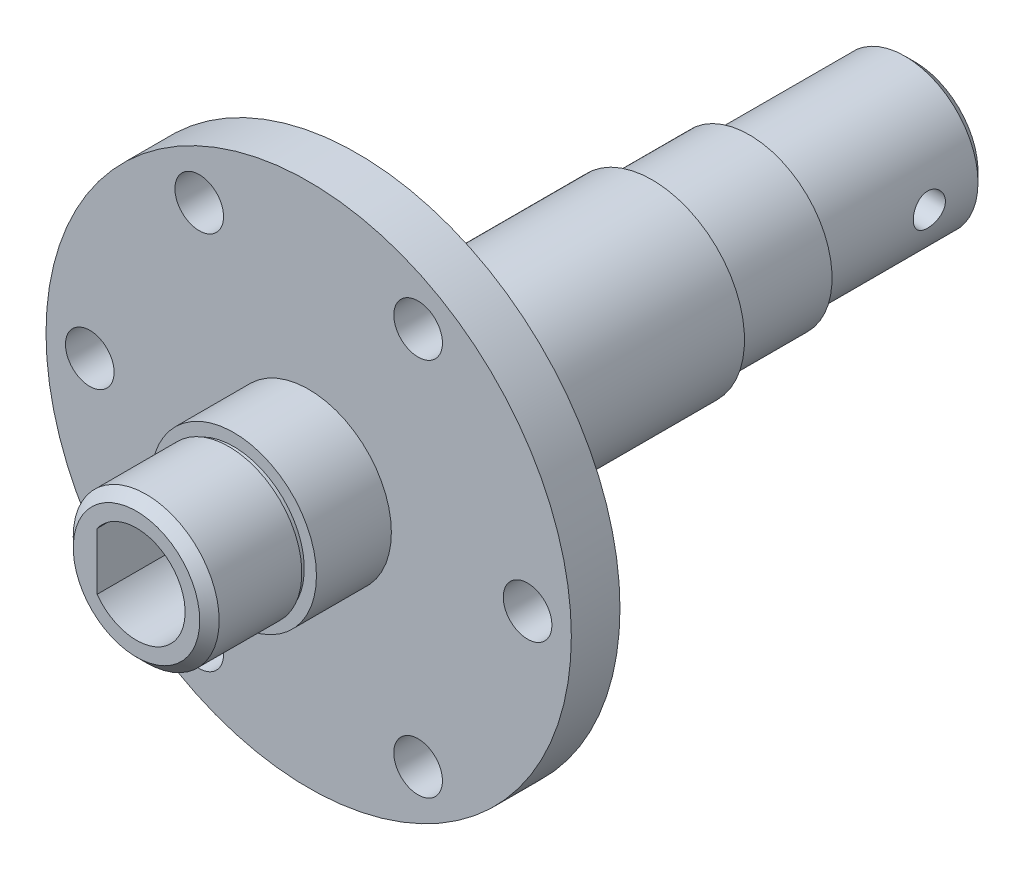
from build123d import *

# Parameters (mm, degrees)
SKETCH_1_R                = 7
EXTRUDE_1_DEPTH           = 54
SKETCH_2_R                = 5
EXTRUDE_2_DEPTH           = 7
CHAMFER_1_SIZE            = 1
SKETCH_3_R                = 10
EXTRUDE_3_DEPTH           = 2
SKETCH_4_R                = 6
EXTRUDE_4_DEPTH           = 25
EXTRUDE_START             = 4.3
SKETCH_7_R                = 10
EXTRUDE_5_DEPTH           = 4.3
CUT_EXTRUDE_START         = -1.3
SKETCH_9_R                = 10
SKETCH_9_R_2              = 6
CUT_EXTRUDE_3_DEPTH       = 1.3
SKETCH_11_R               = 27
SKETCH_11_R_2             = 10
EXTRUDE_6_DEPTH           = 5
SKETCH_12_R               = 9.5
SKETCH_12_R_2             = 6
EXTRUDE_7_DEPTH           = 30
SKETCH_14_R               = 2.5
CUT_EXTRUDE_4_DEPTH       = 10
CUT_EXTRUDE_5_DEPTH       = 30
CHAMFER_2_SIZE            = 1
HOLE_WIZARD_M3_1_D        = 2.5
HOLE_WIZARD_M3_1_DEPTH    = 18.5
HOLE_WIZARD_M3_1_TIP      = 0.751075774
CUT_EXTRUDE_10_DEPTH      = 72.965269401
CUT_EXTRUDE_10_DEPTH_BACK = 72.965269401
SKETCH_22_W               = 38.47112098
SKETCH_22_H               = 24.703275639
SKETCH_24_R               = 9.5
EXTRUDE_9_DEPTH           = 10.3
SKETCH_25_R               = 7.5
EXTRUDE_10_DEPTH          = 17
CUT_EXTRUDE_11_DEPTH      = 72.965269401
CUT_EXTRUDE_11_DEPTH_BACK = 72.965269401
SKETCH_26_W               = 19.870375241
SKETCH_26_H               = 17.333591793
EXTRUDE_START_2           = 7.7
SKETCH_27_R               = 9.5
EXTRUDE_11_DEPTH          = 7.7
EXTRUDE_START_3           = 10
SKETCH_29_R               = 7.5
EXTRUDE_12_DEPTH          = 10
CUT_EXTRUDE_12_REACH      = 90.645
HOLE_WIZARD_M4_1_D        = 3.3
CHAMFER_4_SIZE            = 1
CUT_EXTRUDE_START_2       = -10
SKETCH_33_R               = 9.5
SKETCH_33_R_2             = 8.5
CUT_EXTRUDE_13_DEPTH      = 10
SKETCH_34_R               = 9.5
SKETCH_34_R_2             = 8.5
CUT_EXTRUDE_14_DEPTH      = 7.7
SKETCH_35_W               = 0.25
SKETCH_35_H               = 0.5
SKETCH_36_W               = 0.25
SKETCH_36_H               = 0.5


with BuildPart() as part:
    # 草图1 → 凸台-拉伸1 (new body)
    with BuildSketch(Plane.XY):
        Circle(SKETCH_1_R)
    extrude(amount=EXTRUDE_1_DEPTH)

    # 草图2 → 凸台-拉伸2 (add)
    with BuildSketch(Plane.XY.offset(54)):
        Circle(SKETCH_2_R)
    extrude(amount=EXTRUDE_2_DEPTH)

    # 倒角1
    chamfer_1_edges = [part.edges().sort_by_distance(p)[0] for p in [
        (-5, 0, 61),
    ]]
    chamfer(chamfer_1_edges, length=CHAMFER_1_SIZE)

    # 草图3 → 凸台-拉伸3 (add)
    with BuildSketch(Plane.XY.offset(42)):
        Circle(SKETCH_3_R)
    extrude(amount=-EXTRUDE_3_DEPTH)

    # 草图4 → 凸台-拉伸4 (add)
    with BuildSketch(Plane(origin=(0, 0, 0), x_dir=(-1, 0, 0), z_dir=(0, 0, -1))):
        with Locations(Location((0, 0, 0), (0, 0, 180))):
            Circle(SKETCH_4_R)
    extrude(amount=EXTRUDE_4_DEPTH)

    # 草图7 → 凸台-拉伸5 (add)
    with BuildSketch(Plane.XY.offset(42).offset(EXTRUDE_START)):
        Circle(SKETCH_7_R)
    extrude(amount=-EXTRUDE_5_DEPTH)

    # 草图9 → 切除-拉伸3 (cut)
    with BuildSketch(Plane(origin=(0, 0, 40), x_dir=(-1, 0, 0), z_dir=(0, 0, -1)).offset(CUT_EXTRUDE_START)):
        with Locations(Location((0, 0, 0), (0, 0, 180))):
            Circle(SKETCH_9_R)
        Circle(SKETCH_9_R_2, mode=Mode.SUBTRACT)
    extrude(amount=CUT_EXTRUDE_3_DEPTH, mode=Mode.SUBTRACT)

    # 草图11 → 凸台-拉伸6 (add)
    with BuildSketch(Plane.XY.offset(46.3)):
        Circle(SKETCH_11_R)
        Circle(SKETCH_11_R_2, mode=Mode.SUBTRACT)
    extrude(amount=-EXTRUDE_6_DEPTH)

    # 草图12 → 凸台-拉伸7 (add)
    with BuildSketch(Plane(origin=(0, 0, 41.3), x_dir=(-1, 0, 0), z_dir=(0, 0, -1))):
        Circle(SKETCH_12_R)
        with Locations(Location((0, 0, 0), (0, 0, 180))):
            Circle(SKETCH_12_R_2, mode=Mode.SUBTRACT)
    extrude(amount=EXTRUDE_7_DEPTH)

    # 草图14 → 切除-拉伸4 (cut)
    with BuildSketch(Plane.XY.offset(46.3)):
        with Locations((22.5, 0)):
            Circle(SKETCH_14_R)
        with Locations((11.25, -19.485571585)):
            Circle(SKETCH_14_R)
        with Locations((-11.25, -19.485571585)):
            Circle(SKETCH_14_R)
        with Locations((-22.5, 0)):
            Circle(SKETCH_14_R)
        with Locations((-11.25, 19.485571585)):
            Circle(SKETCH_14_R)
        with Locations((11.25, 19.485571585)):
            Circle(SKETCH_14_R)
    extrude(amount=-CUT_EXTRUDE_4_DEPTH, mode=Mode.SUBTRACT)

    # 草图13 → 切除-拉伸5 (cut)
    with BuildSketch(Plane(origin=(0, 0, -25), x_dir=(-1, 0, 0), z_dir=(0, 0, -1))):
        with BuildLine():
            Line((2.15, 2.092247595), (2.15, -2.092247595))
            ThreePointArc((2.15, -2.092247595), (0, -3), (-2.15, -2.092247595))
            Line((-2.15, -2.092247595), (-2.15, 2.092247595))
            ThreePointArc((-2.15, 2.092247595), (0, 3), (2.15, 2.092247595))
        make_face()
    extrude(amount=-CUT_EXTRUDE_5_DEPTH, mode=Mode.SUBTRACT)

    # 倒角2
    chamfer_2_edges = [part.edges().sort_by_distance(p)[0] for p in [
        (-6, 0, -25),
    ]]
    chamfer(chamfer_2_edges, length=CHAMFER_2_SIZE)

    # M3 螺纹孔1
    with Locations(Plane(origin=(7.85, 0, -17), x_dir=(0, 0, 1), z_dir=(1, 0, 0))):
        with Locations((0, 0)):
            Hole(HOLE_WIZARD_M3_1_D / 2, depth=HOLE_WIZARD_M3_1_DEPTH)
            with Locations((0, 0, -(HOLE_WIZARD_M3_1_DEPTH + HOLE_WIZARD_M3_1_TIP / 2))):  # 118° drill point
                Cone(0, HOLE_WIZARD_M3_1_D / 2, HOLE_WIZARD_M3_1_TIP, mode=Mode.SUBTRACT)

    # 草图22 → 切除-拉伸10 (cut, two sides: drawn at the far end of the back side and taken through both)
    with BuildSketch(Plane(origin=(0, 0, 0), x_dir=(0, 0, -1), z_dir=(1, 0, 0)).offset(-CUT_EXTRUDE_10_DEPTH_BACK)):
        with Locations((7.93556049, 2.744045787)):
            Rectangle(SKETCH_22_W, SKETCH_22_H)
    extrude(amount=CUT_EXTRUDE_10_DEPTH + CUT_EXTRUDE_10_DEPTH_BACK, mode=Mode.SUBTRACT)

    # 草图24 → 凸台-拉伸9 (add)
    with BuildSketch(Plane(origin=(0, 0, 11.3), x_dir=(-1, 0, 0), z_dir=(0, 0, -1))):
        Circle(SKETCH_24_R)
    extrude(amount=EXTRUDE_9_DEPTH)

    # 草图25 → 凸台-拉伸10 (add)
    with BuildSketch(Plane(origin=(0, 0, 1), x_dir=(-1, 0, 0), z_dir=(0, 0, -1))):
        Circle(SKETCH_25_R)
    extrude(amount=EXTRUDE_10_DEPTH)

    # 草图26 → 切除-拉伸11 (cut, two sides: drawn at the far end of the back side and taken through both)
    with BuildSketch(Plane(origin=(0, 0, 0), x_dir=(0, 0, -1), z_dir=(1, 0, 0)).offset(-CUT_EXTRUDE_11_DEPTH_BACK)):
        with Locations((-56.23518762, 1.256529054)):
            Rectangle(SKETCH_26_W, SKETCH_26_H)
    extrude(amount=CUT_EXTRUDE_11_DEPTH + CUT_EXTRUDE_11_DEPTH_BACK, mode=Mode.SUBTRACT)

    # 草图27 → 凸台-拉伸11 (add)
    with BuildSketch(Plane.XY.offset(46.3).offset(EXTRUDE_START_2)):
        with Locations(Location((0, 0, 0), (0, 0, 180))):
            Circle(SKETCH_27_R)
    extrude(amount=-EXTRUDE_11_DEPTH)

    # 草图29 → 凸台-拉伸12 (add)
    with BuildSketch(Plane.XY.offset(54).offset(EXTRUDE_START_3)):
        with Locations(Location((0, 0, 0), (0, 0, 180))):
            Circle(SKETCH_29_R)
    extrude(amount=-EXTRUDE_12_DEPTH)

    # 草图30 → 切除-拉伸12 (cut, up to next)
    with BuildSketch(Plane(origin=(0, 0, -16), x_dir=(-1, 0, 0), z_dir=(0, 0, -1)), mode=Mode.PRIVATE) as cut_extrude_12_sk1:
        with BuildLine():
            Line((4.05, 2.932149382), (4.05, -2.932149382))
            ThreePointArc((4.05, -2.932149382), (-5, 0), (4.05, 2.932149382))
        make_face()
    cut_extrude_12_tool1 = extrude(cut_extrude_12_sk1.sketch, amount=-CUT_EXTRUDE_12_REACH, mode=Mode.PRIVATE) & part.part
    add(cut_extrude_12_tool1.solids().sort_by_distance((0.224834, 0, -16))[0], mode=Mode.SUBTRACT)

    # M4 螺纹孔1 (through all)
    with Locations(Plane.ZY.offset(9.5)):
        with Locations((-10, 0)):
            Hole(HOLE_WIZARD_M4_1_D / 2)

    # 倒角4
    chamfer_4_edges = [part.edges().sort_by_distance(p)[0] for p in [
        (7.5, 0, -16),
        (7.5, 0, 64),
    ]]
    chamfer(chamfer_4_edges, length=CHAMFER_4_SIZE)

    # 草图33 → 切除-拉伸13 (cut)
    with BuildSketch(Plane(origin=(0, 0, 1), x_dir=(-1, 0, 0), z_dir=(0, 0, -1)).offset(CUT_EXTRUDE_START_2)):
        Circle(SKETCH_33_R)
        Circle(SKETCH_33_R_2, mode=Mode.SUBTRACT)
    extrude(amount=CUT_EXTRUDE_13_DEPTH, mode=Mode.SUBTRACT)

    # 草图34 → 切除-拉伸14 (cut)
    with BuildSketch(Plane.XY.offset(54)):
        with Locations(Location((0, 0, 0), (0, 0, 180))):
            Circle(SKETCH_34_R)
        with Locations(Location((0, 0, 0), (0, 0, 180))):
            Circle(SKETCH_34_R_2, mode=Mode.SUBTRACT)
    extrude(amount=-CUT_EXTRUDE_14_DEPTH, mode=Mode.SUBTRACT)

    # 草图35 → 切除-旋转1 (revolve, cut)
    with BuildSketch(Plane(origin=(0, 0, 0), x_dir=(1, 0, 0), z_dir=(0, 1, 0))):
        with Locations((7.375, -0.75)):
            Rectangle(SKETCH_35_W, SKETCH_35_H)
    revolve(axis=Axis((0, 0, 1), (0, 0, -1)), mode=Mode.SUBTRACT)

    # 草图36 → 切除-旋转2 (revolve, cut)
    with BuildSketch(Plane(origin=(0, 0, 0), x_dir=(1, 0, 0), z_dir=(0, 1, 0))):
        with Locations((7.375, -54.25)):
            Rectangle(SKETCH_36_W, SKETCH_36_H)
    revolve(axis=Axis((0, 0, 54), (0, 0, 1)), mode=Mode.SUBTRACT)


solid = part.part
